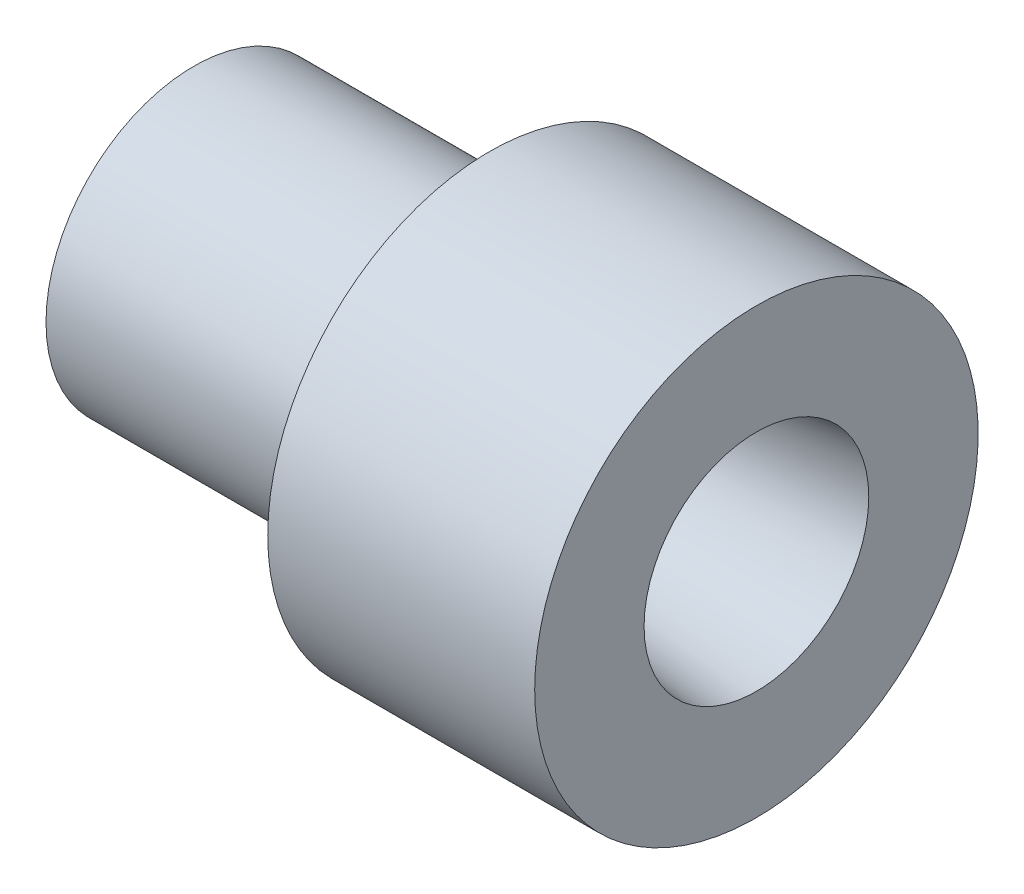
from build123d import *


with BuildPart() as part:
    # Sketch1 → Revolve1 (revolve)
    with BuildSketch(Plane(origin=(0, 0, 0), x_dir=(1, 0, 0), z_dir=(0, 1, 0)), mode=Mode.PRIVATE) as revolve1_sk:
        Polygon((0, 2.286), (0, 6.35), (12.7, 6.35), (12.7, 9.525), (24.166485714, 9.525), (24.166485714, 4.826), align=None)
    revolve(revolve1_sk.sketch.rotate(Axis((0, 0, 0), (1, 0, 0)), 180), axis=Axis((0, 0, 0), (1, 0, 0)))


solid = part.part
